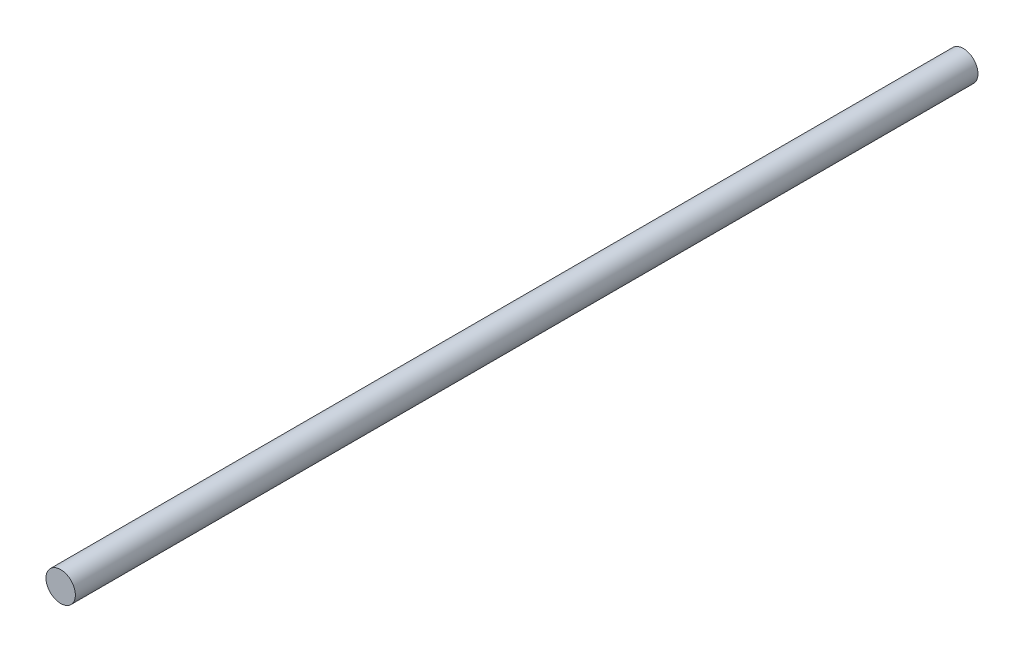
from build123d import *

# Parameters (mm, degrees)
SKETCH1_R           = 2.5
BOSS_EXTRUDE1_DEPTH = 153.5


with BuildPart() as part:
    # Sketch1 → Boss-Extrude1 (new body)
    with BuildSketch(Plane(origin=(0, 0, 0), x_dir=(0, 1, 0), z_dir=(0, 0, 1))):
        with Locations(Location((0, 0, 0), (0, 0, 270))):
            Circle(SKETCH1_R)
    extrude(amount=BOSS_EXTRUDE1_DEPTH)


solid = part.part
